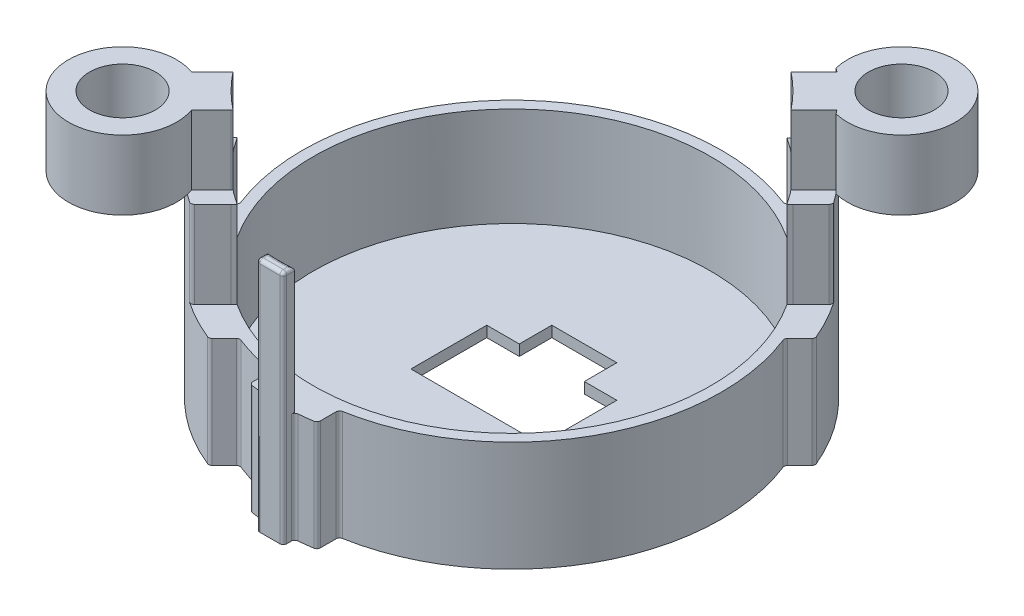
from build123d import *

# Parameters (mm, degrees)
SKETCH1_R             = 15.341599999999996
BOSS_EXTRUDE1_DEPTH   = 0.79375
SKETCH2_R             = 15.341599999999996
SKETCH2_R_2           = 14.547849999999999
BOSS_EXTRUDE2_DEPTH   = 7.264399999999999
CUT_EXTRUDE1_DEPTH    = 2.54
BOSS_EXTRUDE3_DEPTH   = 8.05815
BOSS_EXTRUDE4_START   = -8.05815
BOSS_EXTRUDE4_DEPTH   = 8.05815
BOSS_EXTRUDE5_DEPTH   = 9.21385
BOSS_EXTRUDE6_DEPTH   = 8.05815
BOSS_EXTRUDE7_DEPTH   = 6.35
SKETCH8_R             = 2.4130000000000007
BOSS_EXTRUDE9_DEPTH   = 5.08
BOSS_EXTRUDE9_2_DEPTH = 5.08
FILLET2_R             = 0.254
FILLET3_R             = 0.254
FILLET4_R             = 0.254
FILLET5_R             = 0.254


with BuildPart() as part:
    # Sketch1 → Boss-Extrude1 (new body)
    with BuildSketch(Plane(origin=(0, 0, 0), x_dir=(1, 0, 0), z_dir=(0, 1, 0))):
        Circle(SKETCH1_R)
    extrude(amount=BOSS_EXTRUDE1_DEPTH)

    # Sketch2 → Boss-Extrude2 (add)
    with BuildSketch(Plane(origin=(0, 0.79375, 0), x_dir=(1, 0, 0), z_dir=(0, 1, 0))):
        Circle(SKETCH2_R)
        Circle(SKETCH2_R_2, mode=Mode.SUBTRACT)
    extrude(amount=BOSS_EXTRUDE2_DEPTH)

    # Sketch3 → Cut-Extrude1 (cut)
    with BuildSketch(Plane.XZ):
        Polygon((-4.762499999999998, 2.6415999999999973), (4.762500000000002, 2.641599999999999), (4.762500000000002, -2.914650000000002), (2.38125, -2.9146500000000013), (2.3812499999999996, -5.295900000000002), (-2.3812499999999996, -5.295900000000002), (-2.38125, -2.914650000000002), (-4.762499999999998, -2.914650000000002), align=None)
    extrude(amount=-CUT_EXTRUDE1_DEPTH, mode=Mode.SUBTRACT)

    # Sketch4 → Boss-Extrude3 (add)
    with BuildSketch(Plane(origin=(0, 0, 0), x_dir=(-1, 0, 0), z_dir=(0, -1, 0))):
        with BuildLine():
            Line((2.4765, -15.140397561160668), (2.4765, -16.727897561160667))
            ThreePointArc((2.4765, -16.727897561160667), (8.9e-16, -16.94015526812513), (-2.4765, -16.727897561160667))
            Line((-2.4765, -16.727897561160667), (-2.4765, -15.140397561160668))
            ThreePointArc((-2.4765, -15.140397561160668), (9.4e-16, -15.341599999999993), (2.4765, -15.140397561160668))
        make_face()
    extrude(amount=-BOSS_EXTRUDE3_DEPTH)

    # Sketch5 → Boss-Extrude4 (add)
    with BuildSketch(Plane(origin=(0, 8.058149999999998, 0), x_dir=(1, 0, 0), z_dir=(0, 1, 0)).offset(BOSS_EXTRUDE4_START)):
        with BuildLine():
            Line((-0.9842499999999998, -17.733905268125135), (-0.9842499999999998, -16.906834389214747))
            ThreePointArc((-0.9842499999999998, -16.906834389214747), (8.9e-16, -16.94015526812513), (0.9842499999999998, -16.906834389214747))
            Line((0.9842499999999998, -16.906834389214747), (0.9842499999999998, -17.733905268125135))
            Line((0.9842499999999998, -17.733905268125135), (-0.9842499999999998, -17.733905268125135))
        make_face()
    extrude(amount=BOSS_EXTRUDE4_DEPTH)

    # Sketch5<2> → Boss-Extrude5 (add)
    with BuildSketch(Plane(origin=(0, 8.058149999999998, 0), x_dir=(1, 0, 0), z_dir=(0, 1, 0))):
        with BuildLine():
            Line((-0.9842499999999998, -17.733905268125135), (-0.9842499999999998, -16.906834389214747))
            ThreePointArc((-0.9842499999999998, -16.906834389214747), (8.9e-16, -16.94015526812513), (0.9842499999999998, -16.906834389214747))
            Line((0.9842499999999998, -16.906834389214747), (0.9842499999999998, -17.733905268125135))
            Line((0.9842499999999998, -17.733905268125135), (-0.9842499999999998, -17.733905268125135))
        make_face()
    extrude(amount=BOSS_EXTRUDE5_DEPTH)

    # Sketch6 → Boss-Extrude6 (add)
    with BuildSketch(Plane.XZ):
        with BuildLine():
            Line((-14.239356652921419, 5.7101149437557215), (-15.361888668055064, 6.832646958889366))
            ThreePointArc((-15.361888668055064, 6.832646958889366), (-11.992928475384156, 11.99273189026442), (-6.832904471189303, 15.361785400515926))
            Line((-6.832904471189303, 15.361785400515926), (-5.710372456055659, 14.239253385382282))
            ThreePointArc((-5.710372456055659, 14.239253385382282), (-10.848247486091923, 10.848051301524158), (-14.239356652921419, 5.7101149437557215))
        make_face()
        with BuildLine():
            Line((5.710770125537013, -14.239093901413598), (6.833302140670656, -15.36162591654724))
            ThreePointArc((6.833302140670656, -15.36162591654724), (11.963327436785288, -11.961742370000145), (15.362460815020862, -6.831219984723725))
            Line((15.362460815020862, -6.831219984723725), (14.239928799887219, -5.7086879695900805))
            ThreePointArc((14.239928799887219, -5.7086879695900805), (10.84894249425506, -10.847356236260815), (5.710770125537013, -14.239093901413598))
        make_face()
    extrude(amount=-BOSS_EXTRUDE6_DEPTH)

    # Sketch7 → Boss-Extrude7 (add)
    with BuildSketch(Plane(origin=(0, 8.058149999999998, 0), x_dir=(1, 0, 0), z_dir=(0, 1, 0))):
        with BuildLine():
            Line((-12.397852642860798, -8.176406827123534), (-12.178732573013406, -7.9572867572761385))
            ThreePointArc((-12.178732573013406, -7.9572867572761385), (-10.286832671216615, -10.286934101902759), (-7.957166672199454, -12.178811032828216))
            Line((-7.957166672199454, -12.178811032828216), (-8.176781042381135, -12.398425403009899))
            Line((-8.176781042381135, -12.398425403009899), (-9.67017727909579, -13.891108627568865))
            ThreePointArc((-9.67017727909579, -13.891108627568865), (-11.992935026527139, -11.992725338998914), (-13.89127343793116, -9.669930914310832))
            Line((-13.89127343793116, -9.669930914310832), (-12.397852642860798, -8.176406827123534))
        make_face()
        with BuildLine():
            Line((12.397328282013987, 8.176731564050892), (12.178513827182408, 7.957621540612922))
            ThreePointArc((12.178513827182408, 7.957621540612922), (10.286944170684611, 10.286822602325632), (7.957765463331677, 12.178419784730101))
            Line((7.957765463331677, 12.178419784730101), (8.176438491355439, 12.397035209318538))
            Line((8.176438491355439, 12.397035209318538), (9.646812923187438, 13.867409641150536))
            ThreePointArc((9.646812923187438, 13.867409641150536), (11.962673318277615, 11.962396545053053), (13.867624676203395, 9.646485365886878))
            Line((13.867624676203395, 9.646485365886878), (12.397328282013987, 8.176731564050892))
        make_face()
    extrude(amount=BOSS_EXTRUDE7_DEPTH)

    # Fillet2
    fillet2_edges = [part.edges().sort_by_distance(p)[0] for p in [
        (-2.4765, 4.029075, 15.140397561160668),
        (-2.4765, 4.029075, 16.727897561160667),
        (-0.98425, 4.029074999999998, 16.90683438921475),
        (-0.9842499999999998, 8.635999999999997, 17.733905268125135),
        (0.9842499999999998, 8.635999999999997, 17.733905268125135),
        (0.9842500000000001, 4.029074999999998, 16.90683438921475),
        (2.4765, 4.029075, 16.727897561160667),
        (2.4765, 4.029075, 15.140397561160668),
    ]]
    fillet(fillet2_edges, radius=FILLET2_R)

    # Fillet3
    fillet3_edges = [part.edges().sort_by_distance(p)[0] for p in [
        (-13.891273437931162, 11.233149999999998, 9.669930914310832),
        (-15.361888668055066, 4.029075, 6.832646958889367),
        (-14.23935665292142, 4.029075, 5.7101149437557215),
        (-9.670177279095792, 11.233149999999998, 13.891108627568865),
        (-6.832904471189303, 4.029075, 15.361785400515927),
        (-5.710372456055659, 4.029075, 14.239253385382284),
    ]]
    fillet(fillet3_edges, radius=FILLET3_R)

    # Fillet4
    fillet4_edges = [part.edges().sort_by_distance(p)[0] for p in [
        (14.239928799887219, 4.029075, -5.7086879695900805),
        (15.362460815020864, 4.029075, -6.831219984723724),
        (13.867624676203395, 11.233149999999998, -9.646485365886878),
        (9.646812923187438, 11.233149999999998, -13.867409641150537),
        (6.833302140670657, 4.029075, -15.36162591654724),
        (5.710770125537014, 4.029075, -14.239093901413598),
    ]]
    fillet(fillet4_edges, radius=FILLET4_R)

    # Fillet5
    fillet5_edges = [part.edges().sort_by_distance(p)[0] for p in [
        (1.4e-16, 17.272, 16.94015526812513),
        (0.9842499999999998, 17.272, 17.19336982866994),
        (0.9098551224213829, 17.272, 17.659510390546515),
        (0, 17.272, 17.733905268125135),
        (-0.9098551224213829, 17.272, 17.659510390546515),
        (-0.9842499999999998, 17.272, 17.19336982866994),
    ]]
    fillet(fillet5_edges, radius=FILLET5_R)


with BuildPart() as body_2:
    # Sketch8 → Boss-Extrude9 (new body)
    with BuildSketch(Plane(origin=(0, 14.408149999999997, 0), x_dir=(1, 0, 0), z_dir=(0, 1, 0))):
        with BuildLine():
            ThreePointArc((9.002861818252532, 11.427528985040922), (10.286881765415915, 10.286885007953241), (11.427526147240574, 9.002865420333293))
            Line((11.427526147240576, 9.002865420333293), (13.107599344983733, 10.682708026757702))
            ThreePointArc((13.10759934498373, 10.682708026757698), (13.214235464329633, 10.547779215134643), (13.319365450394756, 10.41167362309261))
            ThreePointArc((13.319365450394747, 10.4116736230926), (17.062486245072215, 17.062487014989735), (10.41166954987871, 13.31937208964741))
            ThreePointArc((10.411669549878741, 13.31937208964743), (10.547905513333946, 13.214140047154249), (10.682962412057378, 13.107398983766892))
            Line((10.682962412057384, 13.107398983766894), (9.002861818252532, 11.427528985040922))
        make_face()
        with Locations((14.260645098988977, 14.26064834152637)):
            Circle(SKETCH8_R, mode=Mode.SUBTRACT)
    extrude(amount=BOSS_EXTRUDE9_DEPTH)


with BuildPart() as body_3:
    # Sketch8 → Boss-Extrude9 2 (new body)
    with BuildSketch(Plane(origin=(0, 14.408149999999997, 0), x_dir=(1, 0, 0), z_dir=(0, 1, 0))):
        with BuildLine():
            Line((-11.427546404588306, -9.002839707196882), (-11.499354003559198, -9.074623095484117))
            Line((-11.499354003559198, -9.074623095484117), (-12.947051587537082, -10.522320679462))
            ThreePointArc((-12.947051587537098, -10.522320679461972), (-17.062500956215068, -17.06247230377446), (-10.522307246446418, -12.947089816829683))
            Line((-10.522307246446541, -12.947089816829621), (-9.074412769810136, -11.499143677885405))
            Line((-9.074412769810136, -11.499143677885405), (-9.002809733874312, -11.427570018081607))
            ThreePointArc((-9.002809733874315, -11.427570018081608), (-10.286869895951533, -10.286896877400084), (-11.427546404588306, -9.002839707196884))
        make_face()
        with Locations((-14.260646720257784, -14.260646720257842)):
            Circle(SKETCH8_R, mode=Mode.SUBTRACT)
    extrude(amount=BOSS_EXTRUDE9_2_DEPTH)


solid = Compound([part.part, body_2.part, body_3.part])
